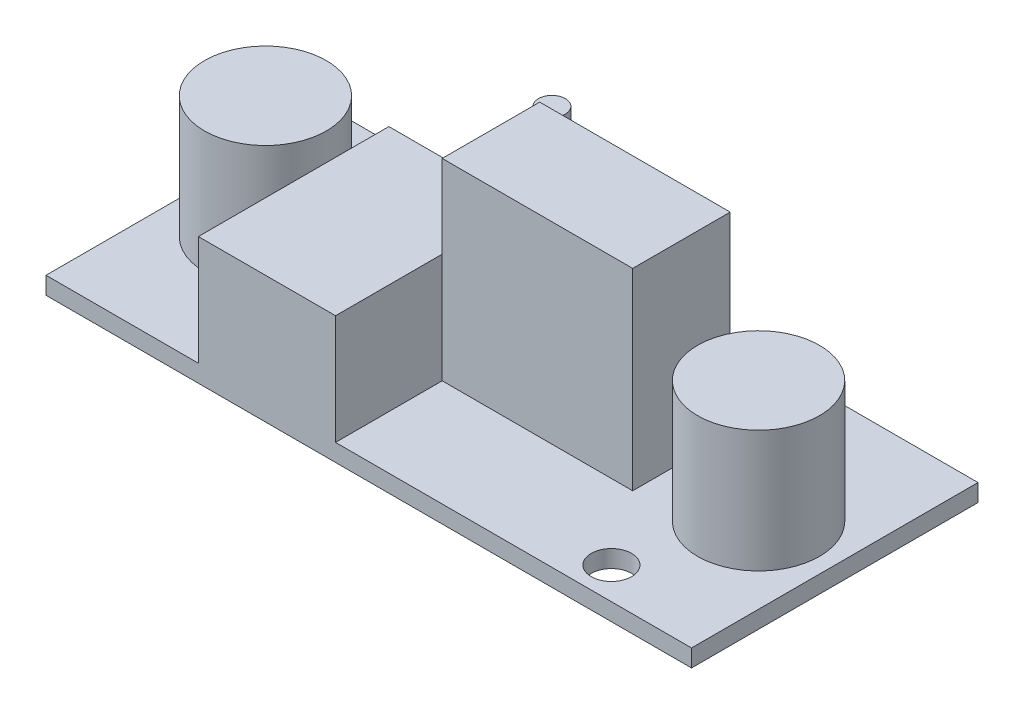
from build123d import *

# Parameters (mm, degrees)
SKETCH1_W           = 53.7972
SKETCH1_H           = 23.876
BOSS_EXTRUDE1_DEPTH = 1.4478
SKETCH2_R           = 1.68275
CUT_EXTRUDE1_DEPTH  = 30.464328446
SKETCH3_R           = 5.08
BOSS_EXTRUDE2_DEPTH = 10.16
SKETCH4_W           = 11.43
SKETCH4_H           = 15.875
BOSS_EXTRUDE3_DEPTH = 9.144
SKETCH5_W           = 9.4742
SKETCH5_H           = 4.2164
BOSS_EXTRUDE4_DEPTH = 9.144
SKETCH6_R           = 1.1176
BOSS_EXTRUDE5_DEPTH = 1.524
SKETCH7_W           = 15.875
SKETCH7_H           = 8.128
BOSS_EXTRUDE6_DEPTH = 16.0528


with BuildPart() as part:
    # Sketch1 → Boss-Extrude1 (new body)
    with BuildSketch(Plane(origin=(0, 0, 0), x_dir=(1, 0, 0), z_dir=(0, 1, 0))):
        Rectangle(SKETCH1_W, SKETCH1_H)
    extrude(amount=BOSS_EXTRUDE1_DEPTH)

    # Sketch2 → Cut-Extrude1 (cut, through all)
    with BuildSketch(Plane(origin=(0, 1.4478, 0), x_dir=(1, 0, 0), z_dir=(0, 1, 0))):
        with Locations(Location((17.5768, -9.29005, 0), (0, 0, 270))):
            Circle(SKETCH2_R)
        with Locations(Location((-17.5768, 9.29005, 0), (0, 0, 270))):
            Circle(SKETCH2_R)
    extrude(amount=-CUT_EXTRUDE1_DEPTH, mode=Mode.SUBTRACT)

    # Sketch3 → Boss-Extrude2 (add)
    with BuildSketch(Plane(origin=(0, 1.4478, 0), x_dir=(1, 0, 0), z_dir=(0, 1, 0))):
        with Locations(Location((20.5486, 0, 0), (0, 0, 270))):
            Circle(SKETCH3_R)
        with Locations(Location((-20.5486, 0, 0), (0, 0, 270))):
            Circle(SKETCH3_R)
    extrude(amount=BOSS_EXTRUDE2_DEPTH)

    # Sketch4 → Boss-Extrude3 (add)
    with BuildSketch(Plane(origin=(0, 1.4478, 0), x_dir=(1, 0, 0), z_dir=(0, 1, 0))):
        with Locations((-8.4836, -4.0005)):
            Rectangle(SKETCH4_W, SKETCH4_H)
    extrude(amount=BOSS_EXTRUDE3_DEPTH)

    # Sketch5 → Boss-Extrude4 (add)
    with BuildSketch(Plane(origin=(0, 1.4478, 0), x_dir=(1, 0, 0), z_dir=(0, 1, 0))):
        with Locations((-3.8735, 9.8298)):
            Rectangle(SKETCH5_W, SKETCH5_H)
    extrude(amount=BOSS_EXTRUDE4_DEPTH)

    # Sketch6 → Boss-Extrude5 (add)
    with BuildSketch(Plane(origin=(0, 10.5918, 0), x_dir=(1, 0, 0), z_dir=(0, 1, 0))):
        with Locations(Location((-7.3406, 10.668, 0), (0, 0, 90))):
            Circle(SKETCH6_R)
    extrude(amount=BOSS_EXTRUDE5_DEPTH)

    # Sketch7 → Boss-Extrude6 (add)
    with BuildSketch(Plane(origin=(0, 1.4478, 0), x_dir=(1, 0, 0), z_dir=(0, 1, 0))):
        with Locations((5.1689, 1.016)):
            Rectangle(SKETCH7_W, SKETCH7_H)
    extrude(amount=BOSS_EXTRUDE6_DEPTH)


solid = part.part
